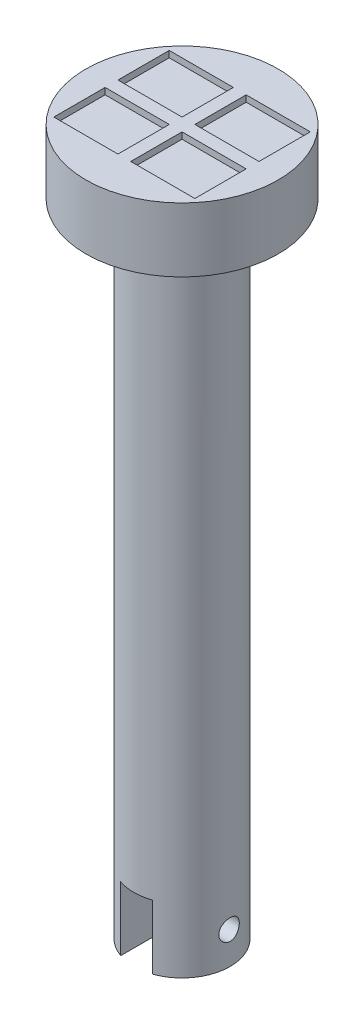
from build123d import *

# Parameters (mm, degrees)
SKETCH_1_R               = 7.5
EXTRUDE_1_DEPTH          = 100
SKETCH_2_R               = 15
EXTRUDE_2_DEPTH          = 10
CUT_EXTRUDE_1_DEPTH      = 113.026782512
CUT_EXTRUDE_1_DEPTH_BACK = 113.026782512
SKETCH_3_W               = 5
SKETCH_3_H               = 10
CUT_EXTRUDE_2_DEPTH      = 113.026782512
CUT_EXTRUDE_2_DEPTH_BACK = 113.026782512
SKETCH_4_R               = 1.6
SKETCH_5_W               = 10
SKETCH_5_H               = 8
CUT_EXTRUDE_3_DEPTH      = 1


with BuildPart() as part:
    # ｽｹｯﾁ1 → ﾎﾞｽ - 押し出し1 (new body)
    with BuildSketch(Plane(origin=(0, 0, 0), x_dir=(1, 0, 0), z_dir=(0, 1, 0))):
        with Locations(Location((0, 0, 0), (0, 0, 270))):
            Circle(SKETCH_1_R)
    extrude(amount=EXTRUDE_1_DEPTH)

    # ｽｹｯﾁ2 → ﾎﾞｽ - 押し出し2 (add)
    with BuildSketch(Plane(origin=(0, 100, 0), x_dir=(1, 0, 0), z_dir=(0, 1, 0))):
        with Locations(Location((0, 0, 0), (0, 0, 270))):
            Circle(SKETCH_2_R)
    extrude(amount=EXTRUDE_2_DEPTH)

    # ｽｹｯﾁ3 → ｶｯﾄ - 押し出し1 (cut, two sides: drawn at the far end of the back side and taken through both)
    with BuildSketch(Plane.XY.offset(-CUT_EXTRUDE_1_DEPTH_BACK)):
        with Locations((0, 5)):
            Rectangle(SKETCH_3_W, SKETCH_3_H)
    extrude(amount=CUT_EXTRUDE_1_DEPTH + CUT_EXTRUDE_1_DEPTH_BACK, mode=Mode.SUBTRACT)

    # ｽｹｯﾁ4 → ｶｯﾄ - 押し出し2 (cut, two sides: drawn at the far end of the back side and taken through both)
    with BuildSketch(Plane(origin=(0, 0, 0), x_dir=(0, 0, -1), z_dir=(1, 0, 0)).offset(-CUT_EXTRUDE_2_DEPTH_BACK)):
        with Locations((0, 5)):
            Circle(SKETCH_4_R)
    extrude(amount=CUT_EXTRUDE_2_DEPTH + CUT_EXTRUDE_2_DEPTH_BACK, mode=Mode.SUBTRACT)

    # ｽｹｯﾁ5 → ｶｯﾄ - 押し出し3 (cut)
    with BuildSketch(Plane(origin=(0, 110, 0), x_dir=(1, 0, 0), z_dir=(0, 1, 0))):
        with Locations((-6, 5)):
            Rectangle(SKETCH_5_W, SKETCH_5_H)
        with Locations((6, 5)):
            Rectangle(SKETCH_5_W, SKETCH_5_H)
        with Locations((6, -5)):
            Rectangle(SKETCH_5_W, SKETCH_5_H)
        with Locations((-6, -5)):
            Rectangle(SKETCH_5_W, SKETCH_5_H)
    extrude(amount=-CUT_EXTRUDE_3_DEPTH, mode=Mode.SUBTRACT)


solid = part.part
